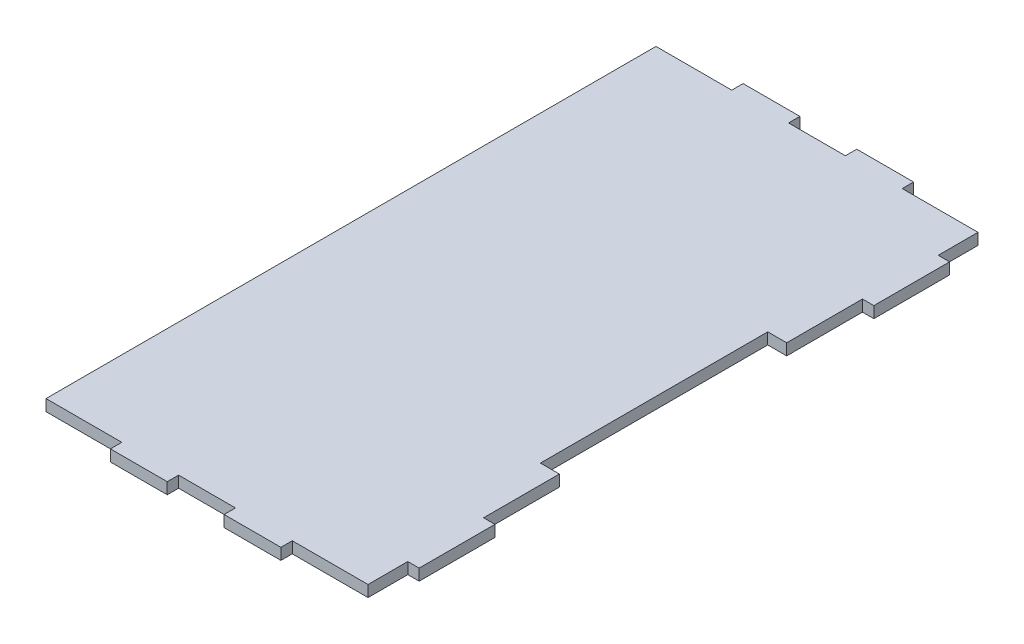
from build123d import *

# Parameters (mm, degrees)
SALIENTE_EXTRUIR1_DEPTH = 3


with BuildPart() as part:
    # Croquis1 → Saliente-Extruir1 (new body)
    with BuildSketch(Plane(origin=(0, 0, 0), x_dir=(1, 0, 0), z_dir=(0, 1, 0))):
        Polygon((25.5, 2.5), (25.5, -0.5), (40.5, -0.5), (40.5, 2.5), (55.5, 2.5), (55.5, -0.5), (70.5, -0.5), (70.5, 2.5), (90.5, 2.5), (90.5, 13), (93.5, 13), (93.5, 33), (90.5, 33), (90.5, 53), (85.5, 53), (85.5, 113), (90.5, 113), (90.5, 133), (93.5, 133), (93.5, 153), (90.5, 153), (90.5, 163.5), (70.5, 163.5), (70.5, 166.5), (55.5, 166.5), (55.5, 163.5), (40.5, 163.5), (40.5, 166.5), (25.5, 166.5), (25.5, 163.5), (5.5, 163.5), (5.5, 153), (5.5, 133), (5.5, 113), (5.5, 93), (5.5, 73), (5.5, 53), (5.5, 33), (5.5, 13), (5.5, 2.5), align=None)
    extrude(amount=SALIENTE_EXTRUIR1_DEPTH)


solid = part.part
